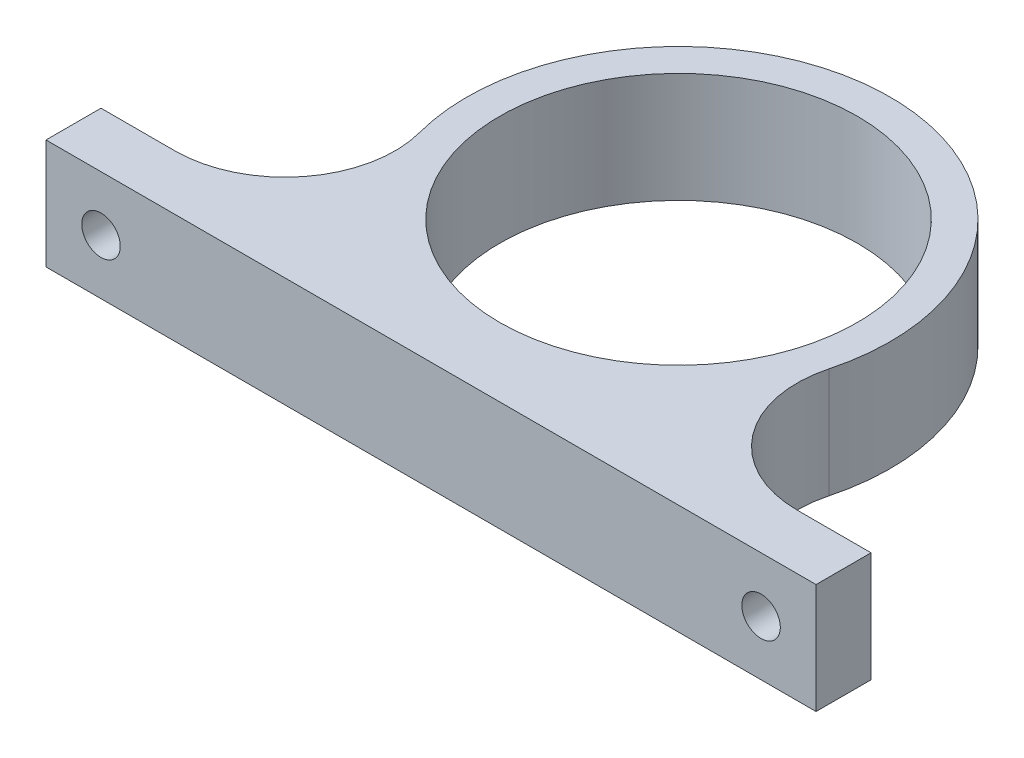
from build123d import *

# Parameters (mm, degrees)
SKETCH1_R           = 19.25
SKETCH1_R_2         = 16.25
BOSS_EXTRUDE1_DEPTH = 10
SKETCH2_W           = 70
SKETCH2_H           = 5
BOSS_EXTRUDE2_DEPTH = 10
FILLET1_R           = 10
SKETCH3_R           = 1.75
CUT_EXTRUDE1_DEPTH  = 52.725839771


with BuildPart() as part:
    # Sketch1 → Boss-Extrude1 (new body)
    with BuildSketch(Plane(origin=(0, 0, 0), x_dir=(1, 0, 0), z_dir=(0, 1, 0))):
        with Locations(Location((0, 0, 0), (0, 0, 270))):
            Circle(SKETCH1_R)
        with Locations(Location((0, 0, 0), (0, 0, 270))):
            Circle(SKETCH1_R_2, mode=Mode.SUBTRACT)
    extrude(amount=BOSS_EXTRUDE1_DEPTH)

    # Sketch2 → Boss-Extrude2 (add)
    with BuildSketch(Plane(origin=(0, 0, 0), x_dir=(1, 0, 0), z_dir=(0, 1, 0))):
        with Locations((0, -20)):
            Rectangle(SKETCH2_W, SKETCH2_H)
    extrude(amount=BOSS_EXTRUDE2_DEPTH)

    # Fillet1
    fillet1_edges = [part.edges().sort_by_distance(p)[0] for p in [
        (8.019507466, 5, 17.5),
        (-8.019507466, 5, 17.5),
    ]]
    fillet(fillet1_edges, radius=FILLET1_R)

    # Sketch3 → Cut-Extrude1 (cut, through all)
    with BuildSketch(Plane(origin=(0, 0, 17.5), x_dir=(-1, 0, 0), z_dir=(0, 0, -1))):
        with Locations((30, 5)):
            Circle(SKETCH3_R)
        with Locations((-30, 5)):
            Circle(SKETCH3_R)
    extrude(amount=-CUT_EXTRUDE1_DEPTH, mode=Mode.SUBTRACT)


solid = part.part
